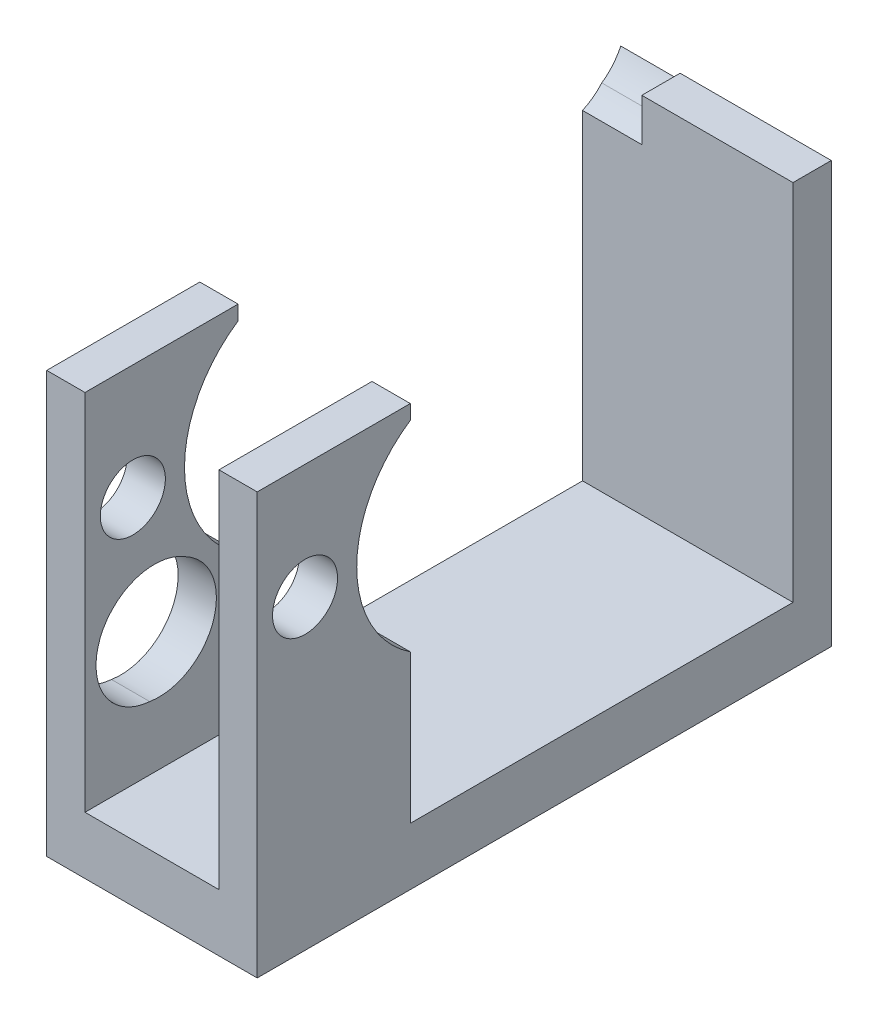
from build123d import *

# Parameters (mm, degrees)
REAR_LOCK_EAR_SKETCH_W             = 2
REAR_LOCK_EAR_SKETCH_H             = 22
REAR_LOCK_EAR_DEPTH                = 8
LOCK_FORK_WEB_SKETCH_W             = 11
LOCK_FORK_WEB_SKETCH_H             = 3
LOCK_FORK_WEB_DEPTH                = 30
FRONT_LOCK_EAR_SKETCH_W            = 2
FRONT_LOCK_EAR_SKETCH_H            = 22
FRONT_LOCK_EAR_DEPTH               = 8
FORK_MOUNTING_FOOT_SKETCH_W        = 11
FORK_MOUNTING_FOOT_SKETCH_H        = 22
FORK_MOUNTING_FOOT_DEPTH           = 2
COUPLING_BARREL_CLEARANCE_SKETCH_R = 6.3
COUPLING_BARREL_CLEARANCE_DEPTH    = 11.3
SERVICE_PIN_CLEARANCE_1_SKETCH_R   = 1.7
SERVICE_PIN_CLEARANCE_1_DEPTH      = 2.3
SERVICE_PIN_CLEARANCE_2_SKETCH_R   = 1.7
SERVICE_PIN_CLEARANCE_2_DEPTH      = 2.3
MOTOR_HEAD_ACCESS_1_1_SKETCH_R     = 3
MOTOR_HEAD_ACCESS_1_1_DEPTH        = 3.2
MOTOR_HEAD_ACCESS_1_5_SKETCH_R     = 3
MOTOR_HEAD_ACCESS_1_5_DEPTH        = 3.2
MOTOR_HEAD_ACCESS_2_1_SKETCH_R     = 3.05
MOTOR_HEAD_ACCESS_2_1_DEPTH        = 3.2
MOTOR_HEAD_ACCESS_2_5_SKETCH_R     = 3.05
MOTOR_HEAD_ACCESS_2_5_DEPTH        = 3.2


with BuildPart() as part:
    # Rear lock ear sketch → Rear lock ear (new body)
    with BuildSketch(Plane.XY.offset(-16)):
        with Locations((-11, -34)):
            Rectangle(REAR_LOCK_EAR_SKETCH_W, REAR_LOCK_EAR_SKETCH_H)
    extrude(amount=REAR_LOCK_EAR_DEPTH)

    # Lock fork web sketch → Lock fork web (add)
    with BuildSketch(Plane.XY.offset(-38)):
        with Locations((-6.5, -43.5)):
            Rectangle(LOCK_FORK_WEB_SKETCH_W, LOCK_FORK_WEB_SKETCH_H)
    extrude(amount=LOCK_FORK_WEB_DEPTH)

    # Front lock ear sketch → Front lock ear (add)
    with BuildSketch(Plane.XY.offset(-16)):
        with Locations((-2, -34)):
            Rectangle(FRONT_LOCK_EAR_SKETCH_W, FRONT_LOCK_EAR_SKETCH_H)
    extrude(amount=FRONT_LOCK_EAR_DEPTH)

    # Fork mounting foot sketch → Fork mounting foot (add)
    with BuildSketch(Plane.XY.offset(-38)):
        with Locations((-6.5, -34)):
            Rectangle(FORK_MOUNTING_FOOT_SKETCH_W, FORK_MOUNTING_FOOT_SKETCH_H)
    extrude(amount=FORK_MOUNTING_FOOT_DEPTH)

    # Coupling barrel clearance sketch → Coupling barrel clearance (cut)
    with BuildSketch(Plane(origin=(-12.1, 0, 0), x_dir=(0, 0, -1), z_dir=(1, 0, 0))):
        with Locations((19.5, -29)):
            Circle(COUPLING_BARREL_CLEARANCE_SKETCH_R)
    extrude(amount=COUPLING_BARREL_CLEARANCE_DEPTH, mode=Mode.SUBTRACT)

    # Service pin clearance 1 sketch → Service pin clearance 1 (cut)
    with BuildSketch(Plane(origin=(-12.1, 0, 0), x_dir=(0, 0, -1), z_dir=(1, 0, 0))):
        with Locations(Location((10.5, -29, 0), (0, 0, 180))):
            Circle(SERVICE_PIN_CLEARANCE_1_SKETCH_R)
    extrude(amount=SERVICE_PIN_CLEARANCE_1_DEPTH, mode=Mode.SUBTRACT)

    # Service pin clearance 2 sketch → Service pin clearance 2 (cut)
    with BuildSketch(Plane(origin=(-3.1, 0, 0), x_dir=(0, 0, -1), z_dir=(1, 0, 0))):
        with Locations(Location((10.5, -29, 0), (0, 0, 180))):
            Circle(SERVICE_PIN_CLEARANCE_2_SKETCH_R)
    extrude(amount=SERVICE_PIN_CLEARANCE_2_DEPTH, mode=Mode.SUBTRACT)

    # Motor head access 1-1 sketch → Motor head access 1-1 (cut)
    with BuildSketch(Plane(origin=(-12.1, 0, 0), x_dir=(0, 0, -1), z_dir=(1, 0, 0))):
        with Locations((34.765, -22.5)):
            Circle(MOTOR_HEAD_ACCESS_1_1_SKETCH_R)
    extrude(amount=MOTOR_HEAD_ACCESS_1_1_DEPTH, mode=Mode.SUBTRACT)

    # Motor head access 1-5 sketch → Motor head access 1-5 (cut)
    with BuildSketch(Plane(origin=(-12.1, 0, 0), x_dir=(0, 0, -1), z_dir=(1, 0, 0))):
        with Locations(Location((11.8675, -35.719877789, 0), (0, 0, 180))):
            Circle(MOTOR_HEAD_ACCESS_1_5_SKETCH_R)
    extrude(amount=MOTOR_HEAD_ACCESS_1_5_DEPTH, mode=Mode.SUBTRACT)

    # Motor head access 2-1 sketch → Motor head access 2-1 (cut)
    with BuildSketch(Plane(origin=(-12.1, 0, 0), x_dir=(0, 0, -1), z_dir=(1, 0, 0))):
        with Locations((35.25, -22)):
            Circle(MOTOR_HEAD_ACCESS_2_1_SKETCH_R)
    extrude(amount=MOTOR_HEAD_ACCESS_2_1_DEPTH, mode=Mode.SUBTRACT)

    # Motor head access 2-5 sketch → Motor head access 2-5 (cut)
    with BuildSketch(Plane(origin=(-12.1, 0, 0), x_dir=(0, 0, -1), z_dir=(1, 0, 0))):
        with Locations((11.625, -35.63990011)):
            Circle(MOTOR_HEAD_ACCESS_2_5_SKETCH_R)
    extrude(amount=MOTOR_HEAD_ACCESS_2_5_DEPTH, mode=Mode.SUBTRACT)


solid = part.part
